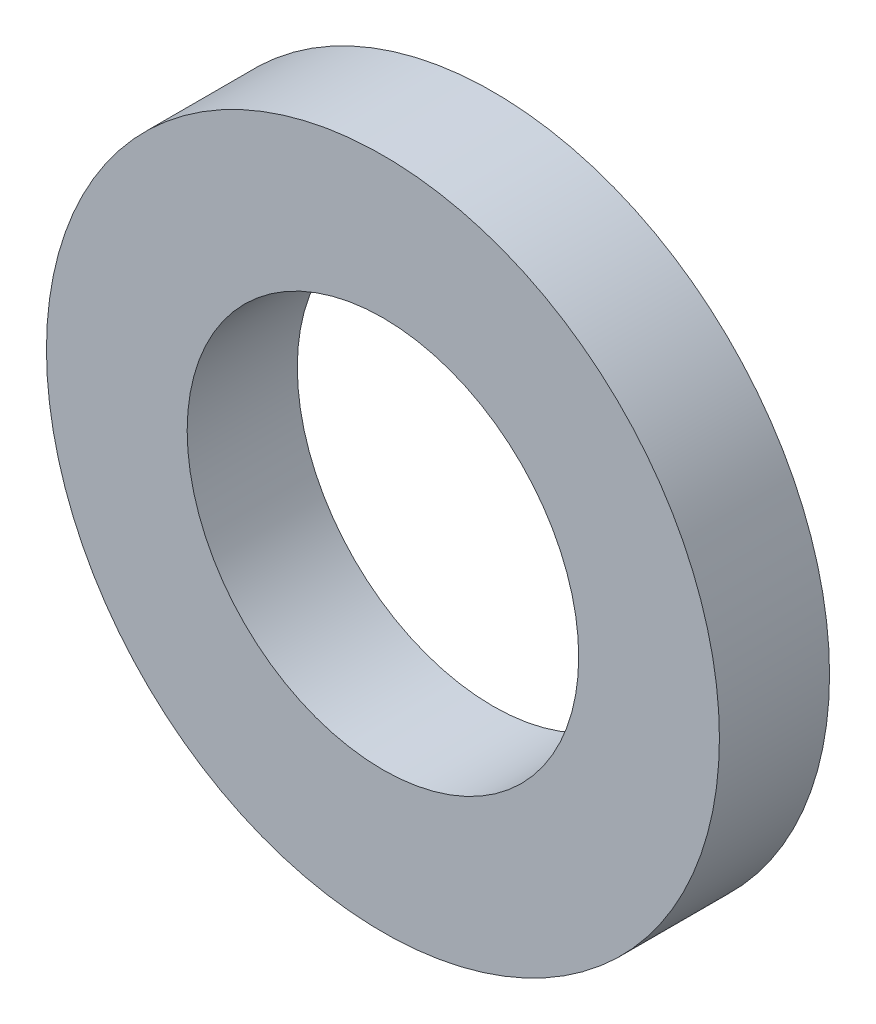
from build123d import *

# Parameters (mm, degrees)
SKETCH1_R           = 5.5
SKETCH1_R_2         = 3.2
BOSS_EXTRUDE1_DEPTH = 1.8


with BuildPart() as part:
    # Sketch1 → Boss-Extrude1 (new body)
    with BuildSketch(Plane.XY):
        with Locations(Location((0, 0, 0), (0, 0, 180))):
            Circle(SKETCH1_R)
        with Locations(Location((0, 0, 0), (0, 0, 180))):
            Circle(SKETCH1_R_2, mode=Mode.SUBTRACT)
    extrude(amount=BOSS_EXTRUDE1_DEPTH)


solid = part.part
